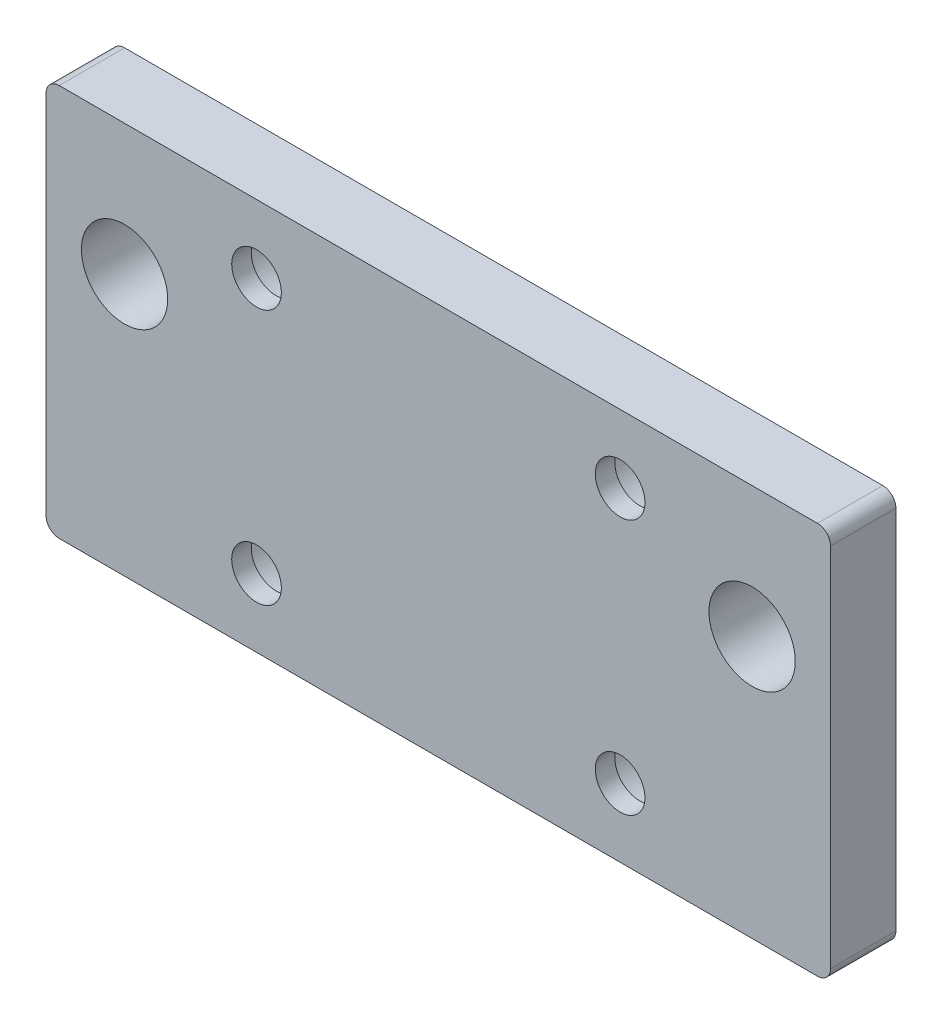
from build123d import *

# Parameters (mm, degrees)
SKETCH1_W                                      = 60
SKETCH1_H                                      = 30
BOSS_EXTRUDE1_DEPTH                            = 5
M6_CLEARANCE_HOLE1_D                           = 6.6
FILLET1_R                                      = 1
CBORE_FOR_6_SOCKET_HEAD_CAP_SCREW1_D           = 3.7973
CBORE_FOR_6_SOCKET_HEAD_CAP_SCREW1_CBORE_D     = 7.14502
CBORE_FOR_6_SOCKET_HEAD_CAP_SCREW1_CBORE_DEPTH = 3.5052


with BuildPart() as part:
    # Sketch1 → Boss-Extrude1 (new body)
    with BuildSketch(Plane.XY):
        with Locations((30, 15)):
            Rectangle(SKETCH1_W, SKETCH1_H)
    extrude(amount=BOSS_EXTRUDE1_DEPTH)

    # M6 Clearance Hole1 (through all)
    with Locations(Plane.XY.offset(5)):
        with Locations((6, 20), (54, 20)):
            Hole(M6_CLEARANCE_HOLE1_D / 2)

    # Fillet1
    fillet1_edges = [part.edges().sort_by_distance(p)[0] for p in [
        (0, 30, 2.5),
        (60, 30, 2.5),
        (60, 0, 2.5),
        (0, 0, 2.5),
    ]]
    fillet(fillet1_edges, radius=FILLET1_R)

    # CBORE for #6 Socket Head Cap Screw1 (through all)
    with Locations(Plane(origin=(0, 0, 0), x_dir=(-1, 0, 0), z_dir=(0, 0, -1))):
        with Locations((-43.9055, 24.779), (-16.0945, 24.779), (-43.9055, 5.221), (-16.0945, 5.221)):
            CounterBoreHole(CBORE_FOR_6_SOCKET_HEAD_CAP_SCREW1_D / 2, CBORE_FOR_6_SOCKET_HEAD_CAP_SCREW1_CBORE_D / 2, CBORE_FOR_6_SOCKET_HEAD_CAP_SCREW1_CBORE_DEPTH)


solid = part.part
